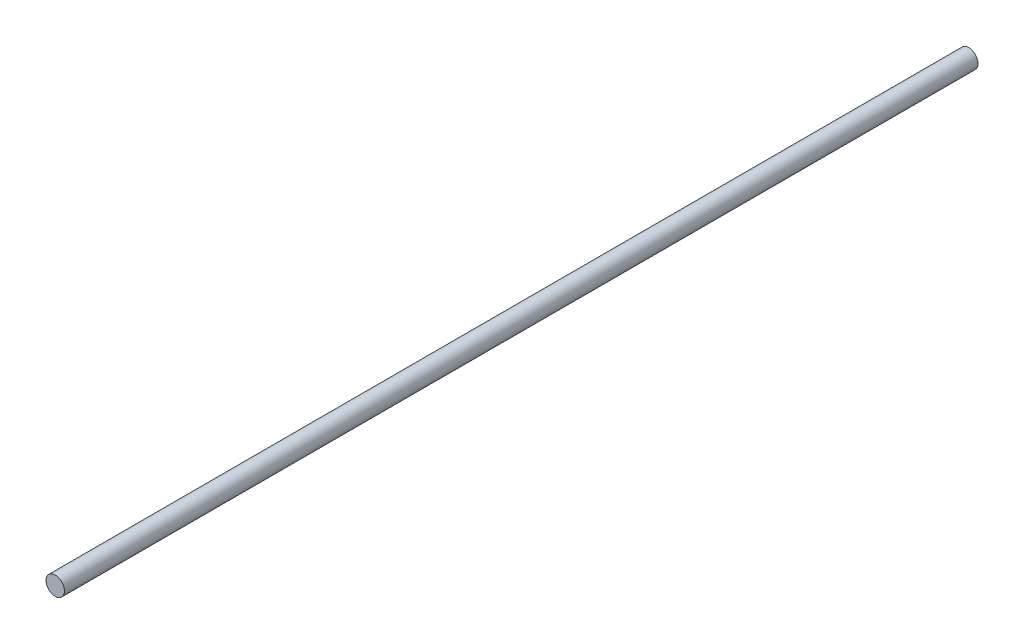
from build123d import *

# Parameters (mm, degrees)
SKETCH1_R           = 5
BOSS_EXTRUDE1_DEPTH = 495


with BuildPart() as part:
    # Sketch1 → Boss-Extrude1 (new body)
    with BuildSketch(Plane.XY):
        Circle(SKETCH1_R)
    extrude(amount=BOSS_EXTRUDE1_DEPTH)


solid = part.part
